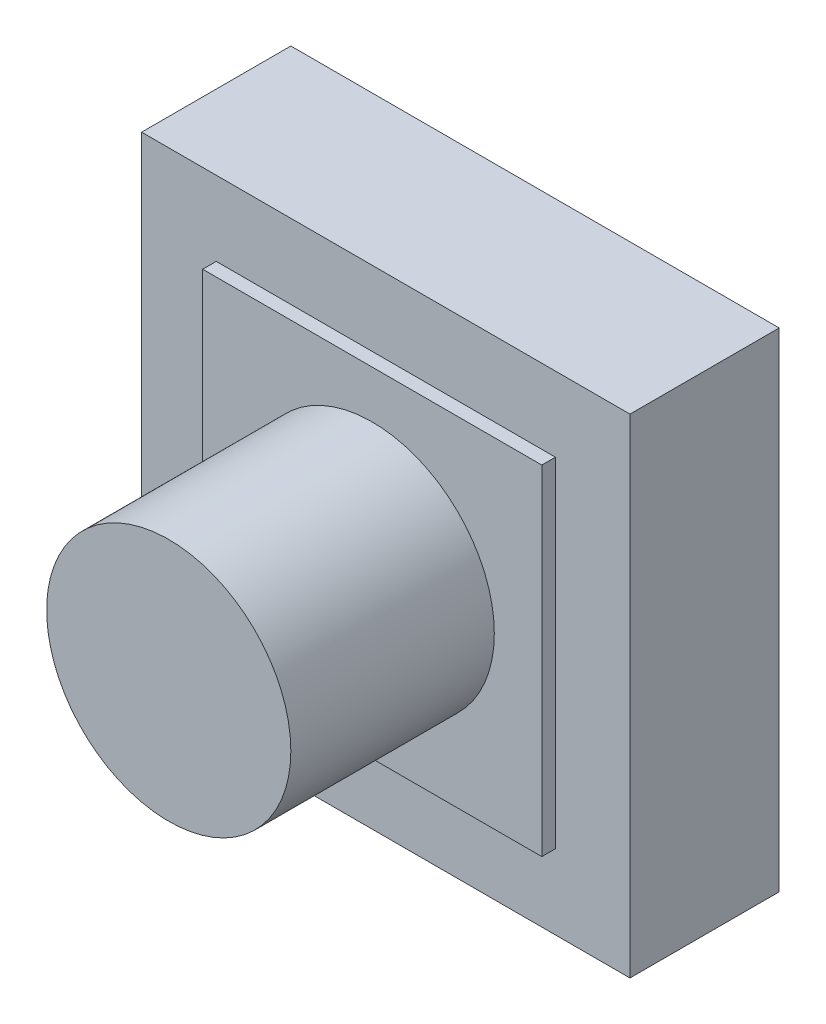
from build123d import *

# Parameters (mm, degrees)
SKETCH_1_W      = 36
SKETCH_1_H      = 36
EXTRUDE_1_DEPTH = 11
SKETCH_2_W      = 25
SKETCH_2_H      = 25
EXTRUDE_2_DEPTH = 1
SKETCH_3_R      = 9
EXTRUDE_3_DEPTH = 15


with BuildPart() as part:
    # 草图1 → 凸台-拉伸1 (new body)
    with BuildSketch(Plane.XY):
        Rectangle(SKETCH_1_W, SKETCH_1_H)
    extrude(amount=EXTRUDE_1_DEPTH)

    # 草图2 → 凸台-拉伸2 (add)
    with BuildSketch(Plane.XY.offset(11)):
        Rectangle(SKETCH_2_W, SKETCH_2_H)
    extrude(amount=EXTRUDE_2_DEPTH)

    # 草图3 → 凸台-拉伸3 (add)
    with BuildSketch(Plane.XY.offset(12)):
        Circle(SKETCH_3_R)
    extrude(amount=EXTRUDE_3_DEPTH)


solid = part.part
